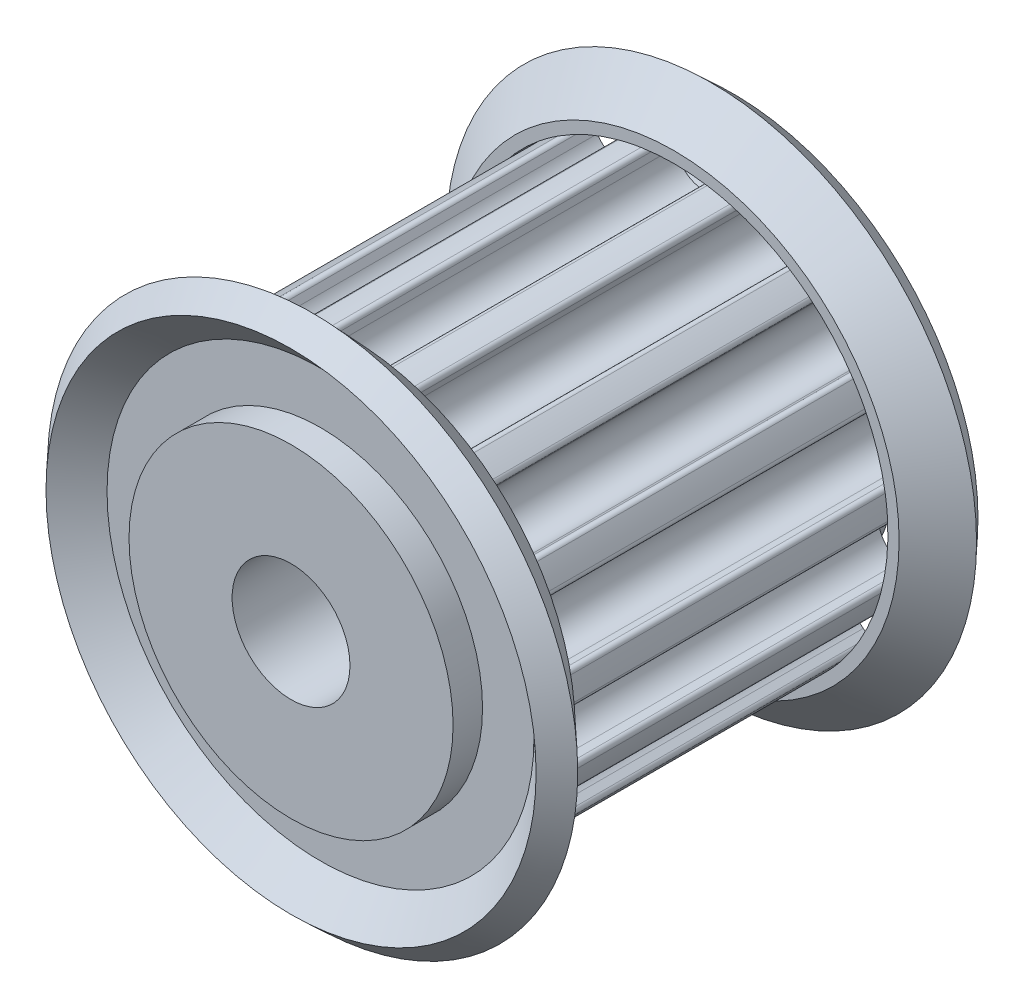
from build123d import *

# Parameters (mm, degrees)
CUT_EXTRUDE_START        = -7
CUT_EXTRUDE_1_DEPTH      = 14
CUT_EXTRUDE_START_2      = -9
SKETCH_5_R               = 2
CUT_EXTRUDE_H_DEPTH      = 18
PATTERN_CIRCULAR_1_COUNT = 15


with BuildPart() as part:
    # 草图3 → 旋转1 (revolve)
    with BuildSketch(Plane(origin=(0, 0, 0), x_dir=(0, 0, -1), z_dir=(1, 0, 0)), mode=Mode.PRIVATE) as revolve_1_sk:
        Polygon((6, 5.5), (6, 0), (-1.5, 0), (-9, 0), (-9, 5.5), (-8, 5.5), (-8, 7.245957379), (-9, 8.317834339), (-8.268802345, 9), (-7, 7.64), (-7, 7.26), (-1.5, 7.26), (4, 7.26), (4, 7.64), (5.268802345, 9), (6, 8.317834339), (5, 7.245957379), (5, 5.5), align=None)
    revolve(revolve_1_sk.sketch.rotate(Axis((0, 0, 34.781081475), (0, 0, -1)), 90), axis=Axis((0, 0, 34.781081475), (0, 0, -1)))

    # 草图4 → Cut-Extrude 1 (cut)
    with BuildSketch(Plane.XY.offset(CUT_EXTRUDE_START)):
        with BuildLine():
            Line((-0.919370356, 6.793390182), (-0.95, 7.04284861))
            ThreePointArc((-0.95, 7.04284861), (-1.008495713, 7.144277578), (-1.122065086, 7.17276585))
            ThreePointArc((-1.122065086, 7.17276585), (0, 7.26), (1.122065086, 7.17276585))
            ThreePointArc((1.122065086, 7.17276585), (1.008495713, 7.144277578), (0.95, 7.04284861))
            Line((0.95, 7.04284861), (0.919370356, 6.793390182))
            ThreePointArc((0.919370356, 6.793390182), (0, 5.98), (-0.919370356, 6.793390182))
        make_face()
    cut_extrude_1 = extrude(amount=CUT_EXTRUDE_1_DEPTH, mode=Mode.SUBTRACT)

    # 草图5 → H (cut)
    with BuildSketch(Plane.XY.offset(CUT_EXTRUDE_START_2)):
        Circle(SKETCH_5_R)
    extrude(amount=CUT_EXTRUDE_H_DEPTH, mode=Mode.SUBTRACT)

    # 阵列(圆周)1: Cut-Extrude 1 ×15 about axis
    pattern_circular_1_axis = Axis((0, 0, 0), (0, 0, 1))
    for i in range(1, PATTERN_CIRCULAR_1_COUNT):
        add(cut_extrude_1.rotate(pattern_circular_1_axis, i * 360 / PATTERN_CIRCULAR_1_COUNT), mode=Mode.SUBTRACT)


solid = part.part
